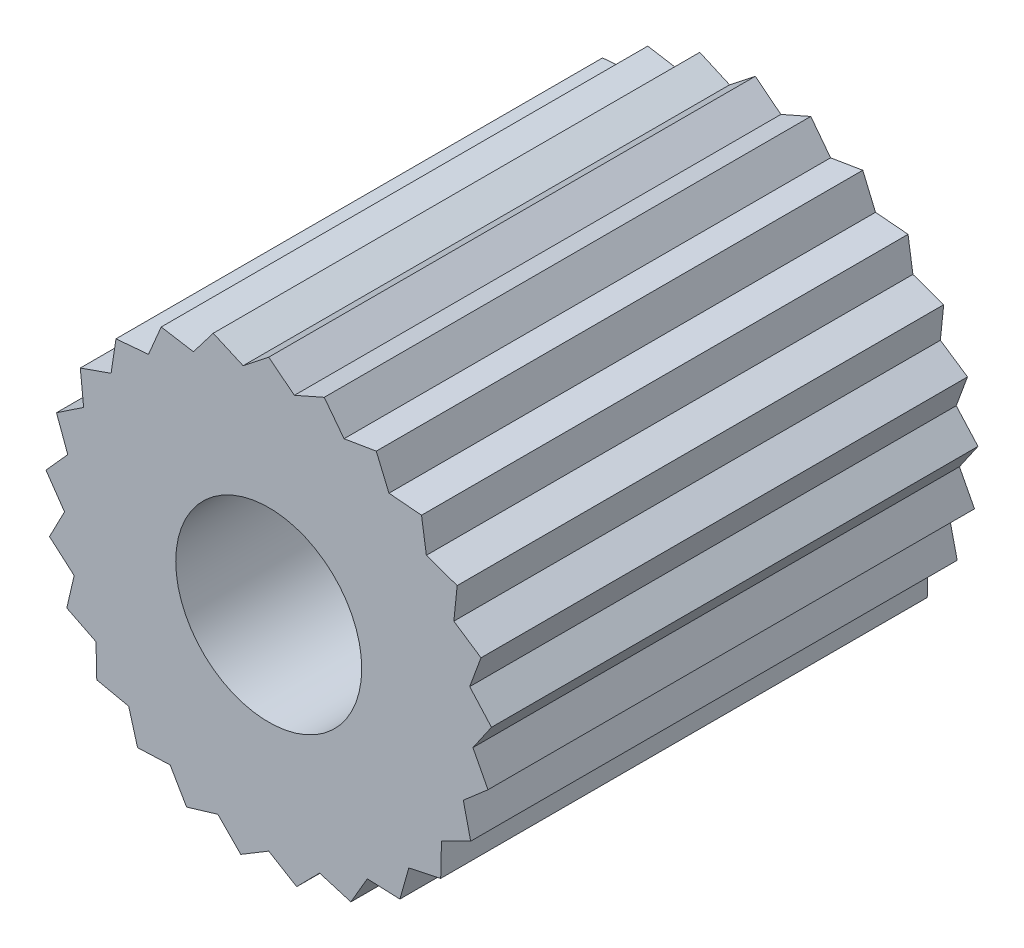
from build123d import *

# Parameters (mm, degrees)
BOSS_EXTRUDE1_DEPTH = 6.539992
SKETCH2_R           = 1.25000004
CUT_EXTRUDE1_DEPTH  = 5.08


with BuildPart() as part:
    # Sketch1 → Boss-Extrude1 (new body)
    with BuildSketch(Plane.XY):
        Polygon((-10.594624819, 2.728309468), (-10.24995918, 2.999994), (-9.905293541, 2.728309468), (-9.503891011, 2.905743672), (-9.237618872, 2.55687975), (-8.804701048, 2.628914782), (-8.633553268, 2.224791874), (-8.196321969, 2.186901508), (-8.131052392, 1.752912142), (-7.716980469, 1.60747717), (-7.761690222, 1.170890494), (-7.396795337, 0.927049129), (-7.548675142, 0.515297489), (-7.255884983, 0.188371182), (-7.505391673, -0.172673551), (-7.303103322, -0.562142819), (-7.634559474, -0.849794878), (-7.535483452, -1.27733532), (-7.928062458, -1.473520467), (-7.938424075, -1.912268145), (-8.367458751, -2.004659346), (-8.48660695, -2.427046129), (-8.925139471, -2.409838105), (-9.145587731, -2.789323879), (-9.566063484, -2.663597874), (-9.873960231, -2.976338151), (-10.24995918, -2.749993992), (-10.625958129, -2.976338151), (-10.933854876, -2.663597874), (-11.354330629, -2.789323879), (-11.574778889, -2.409838105), (-12.01331141, -2.427046129), (-12.132459609, -2.004659346), (-12.561494285, -1.912268145), (-12.571855902, -1.473520467), (-12.964434908, -1.27733532), (-12.865358886, -0.849794878), (-13.196815038, -0.562142819), (-12.994526687, -0.172673551), (-13.244033377, 0.188371182), (-12.951243218, 0.515297489), (-13.103123023, 0.927049129), (-12.738228138, 1.170890494), (-12.782937891, 1.60747717), (-12.368865968, 1.752912142), (-12.303596391, 2.186901508), (-11.866365092, 2.224791874), (-11.695217312, 2.628914782), (-11.262299488, 2.55687975), (-10.996027349, 2.905743672), align=None)
    extrude(amount=BOSS_EXTRUDE1_DEPTH)

    # Sketch2 → Cut-Extrude1 (cut)
    with BuildSketch(Plane.XY.offset(6.539992)):
        with Locations((-10.24995918, 0)):
            Circle(SKETCH2_R)
    extrude(amount=-CUT_EXTRUDE1_DEPTH, mode=Mode.SUBTRACT)


solid = part.part
